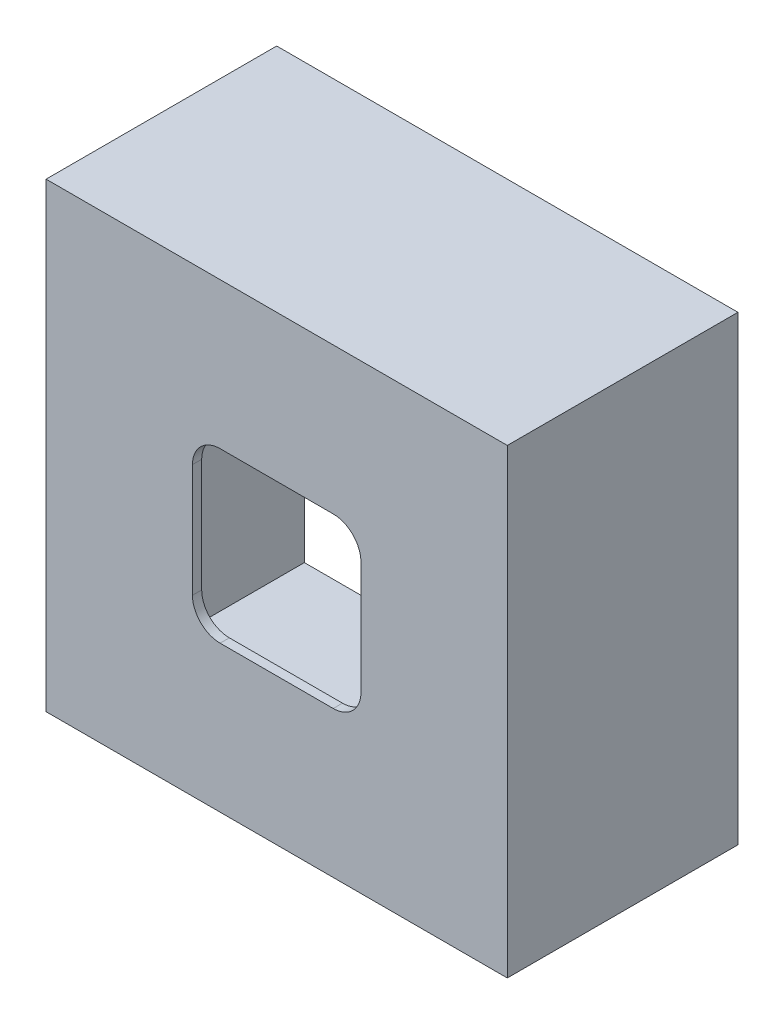
from build123d import *

# Parameters (mm, degrees)
SKETCH1_W           = 100
SKETCH1_H           = 100
BOSS_EXTRUDE1_DEPTH = 2
SKETCH2_W           = 100
SKETCH2_H           = 100
SKETCH2_W_2         = 88
SKETCH2_H_2         = 88
BOSS_EXTRUDE2_DEPTH = 48


with BuildPart() as part:
    # Sketch1 → Boss-Extrude1 (new body)
    with BuildSketch(Plane.XY):
        Rectangle(SKETCH1_W, SKETCH1_H)
        with BuildLine():
            Line((12.263455967, 18.263455967), (-12.263455967, 18.263455967))
            ThreePointArc((-12.263455967, 18.263455967), (-16.506096654, 16.506096654), (-18.263455967, 12.263455967))
            Line((-18.263455967, 12.263455967), (-18.263455967, -12.263455967))
            ThreePointArc((-18.263455967, -12.263455967), (-16.506096654, -16.506096654), (-12.263455967, -18.263455967))
            Line((-12.263455967, -18.263455967), (12.263455967, -18.263455967))
            ThreePointArc((12.263455967, -18.263455967), (16.506096654, -16.506096654), (18.263455967, -12.263455967))
            Line((18.263455967, -12.263455967), (18.263455967, 12.263455967))
            ThreePointArc((18.263455967, 12.263455967), (16.506096654, 16.506096654), (12.263455967, 18.263455967))
        make_face(mode=Mode.SUBTRACT)
    extrude(amount=-BOSS_EXTRUDE1_DEPTH)

    # Sketch2 → Boss-Extrude2 (add)
    with BuildSketch(Plane(origin=(0, 0, -2), x_dir=(-1, 0, 0), z_dir=(0, 0, -1))):
        Rectangle(SKETCH2_W, SKETCH2_H)
        Rectangle(SKETCH2_W_2, SKETCH2_H_2, mode=Mode.SUBTRACT)
    extrude(amount=BOSS_EXTRUDE2_DEPTH)


solid = part.part
